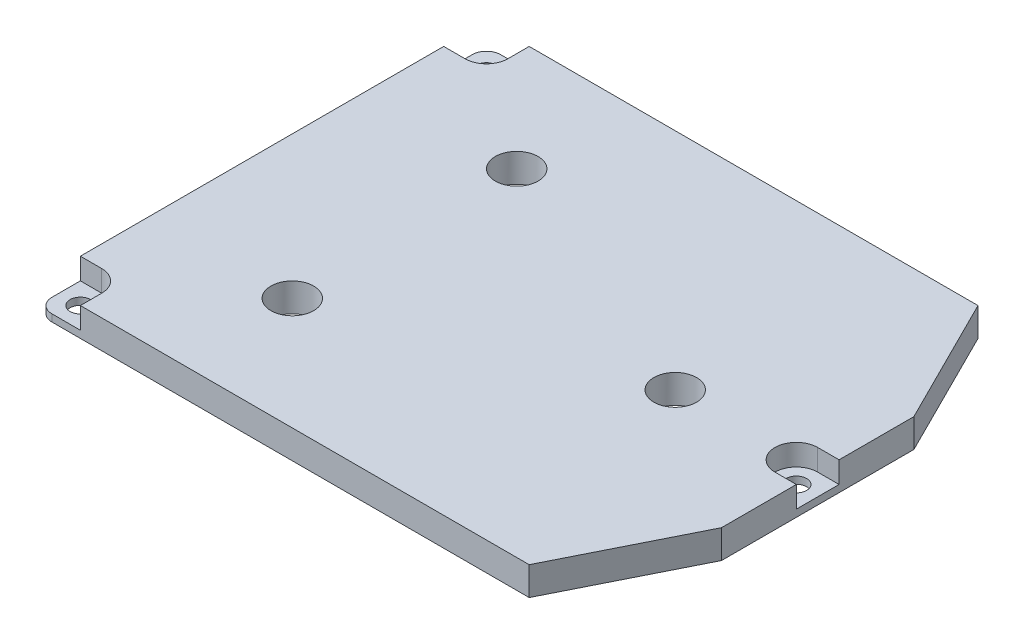
from build123d import *

# Parameters (mm, degrees)
SALIENTE_EXTRUIR1_DEPTH = 4
CROQUIS2_R              = 1.45
CORTAR_EXTRUIR1_DEPTH   = 4
REDONDEO1_R             = 2
CORTAR_EXTRUIR2_DEPTH   = 3
CROQUIS4_R              = 3
CORTAR_EXTRUIR3_DEPTH   = 10


with BuildPart() as part:
    # Croquis1 → Saliente-Extruir1 (new body)
    with BuildSketch(Plane(origin=(0, 0, 0), x_dir=(1, 0, 0), z_dir=(0, 1, 0))):
        Polygon((63, 0), (69, 0), (78, 18), (78, 45), (69, 63), (63, 63), (0, 63), (0, 0), align=None)
    extrude(amount=SALIENTE_EXTRUIR1_DEPTH)

    # Croquis2 → Cortar-Extruir1 (cut)
    with BuildSketch(Plane(origin=(0, 4, 0), x_dir=(1, 0, 0), z_dir=(0, 1, 0))):
        with Locations(Location((3, 3, 0), (0, 0, 270))):
            Circle(CROQUIS2_R)
        with Locations(Location((3, 60, 0), (0, 0, 270))):
            Circle(CROQUIS2_R)
        with Locations(Location((75, 31.5, 0), (0, 0, 270))):
            Circle(CROQUIS2_R)
    extrude(amount=-CORTAR_EXTRUIR1_DEPTH, mode=Mode.SUBTRACT)

    # Redondeo1
    redondeo1_edges = [part.edges().sort_by_distance(p)[0] for p in [
        (0, 2, -63),
        (0, 2, 0),
    ]]
    fillet(redondeo1_edges, radius=REDONDEO1_R)

    # Croquis3 → Cortar-Extruir2 (cut)
    with BuildSketch(Plane(origin=(0, 4, 0), x_dir=(1, 0, 0), z_dir=(0, 1, 0))):
        with BuildLine():
            Line((6, 3), (6, 0))
            Line((6, 0), (0, 0))
            Line((0, 0), (0, 3))
            Line((0, 3), (0, 6))
            Line((0, 6), (3, 6))
            ThreePointArc((3, 6), (5.121320344, 5.121320344), (6, 3))
        make_face()
        with BuildLine():
            Line((3, 57), (0, 57))
            Line((0, 57), (0, 63))
            Line((0, 63), (6, 63))
            Line((6, 63), (6, 60))
            ThreePointArc((6, 60), (5.121320344, 57.878679656), (3, 57))
        make_face()
        with BuildLine():
            Line((75, 28.5), (78, 28.5))
            Line((78, 28.5), (78, 34.5))
            Line((78, 34.5), (75, 34.5))
            ThreePointArc((75, 34.5), (72, 31.5), (75, 28.5))
        make_face()
    extrude(amount=-CORTAR_EXTRUIR2_DEPTH, mode=Mode.SUBTRACT)

    # Croquis4 → Cortar-Extruir3 (cut)
    with BuildSketch(Plane(origin=(0, 4, 0), x_dir=(1, 0, 0), z_dir=(0, 1, 0))):
        with Locations(Location((20, 47.25, 0), (0, 0, 270))):
            Circle(CROQUIS4_R)
        with Locations(Location((20, 15.75, 0), (0, 0, 270))):
            Circle(CROQUIS4_R)
        with Locations(Location((58, 31.5, 0), (0, 0, 270))):
            Circle(CROQUIS4_R)
    extrude(amount=-CORTAR_EXTRUIR3_DEPTH, mode=Mode.SUBTRACT)


solid = part.part
